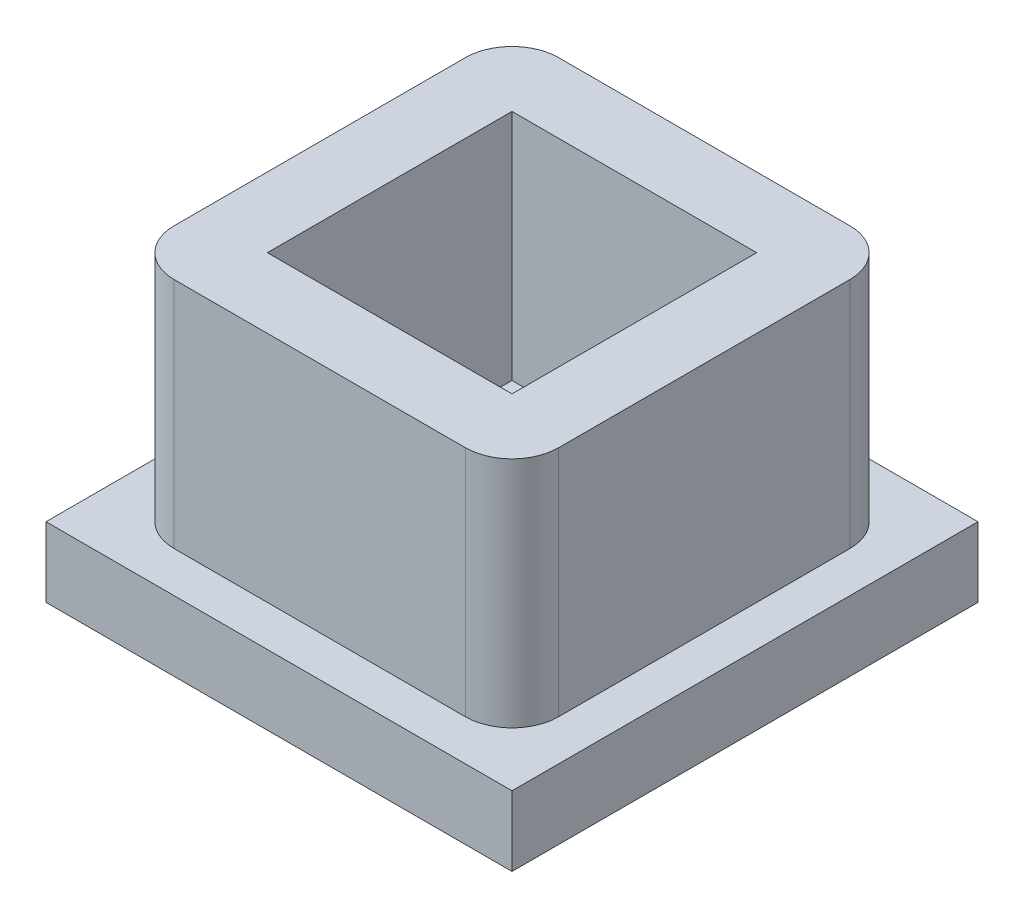
from build123d import *

# Parameters (mm, degrees)
SKETCH1_W           = 20
SKETCH1_H           = 20
BOSS_EXTRUDE1_DEPTH = 3
SKETCH2_W           = 16.5
SKETCH2_H           = 16.5
SKETCH2_W_2         = 10.5
SKETCH2_H_2         = 10.5
BOSS_EXTRUDE2_DEPTH = 10
FILLET1_R           = 2


with BuildPart() as part:
    # Sketch1 → Boss-Extrude1 (new body)
    with BuildSketch(Plane(origin=(0, 0, 0), x_dir=(1, 0, 0), z_dir=(0, 1, 0))):
        Rectangle(SKETCH1_W, SKETCH1_H)
    extrude(amount=BOSS_EXTRUDE1_DEPTH)

    # Sketch2 → Boss-Extrude2 (add)
    with BuildSketch(Plane(origin=(0, 3, 0), x_dir=(1, 0, 0), z_dir=(0, 1, 0))):
        Rectangle(SKETCH2_W, SKETCH2_H)
        Rectangle(SKETCH2_W_2, SKETCH2_H_2, mode=Mode.SUBTRACT)
    extrude(amount=BOSS_EXTRUDE2_DEPTH)

    # Fillet1
    fillet1_edges = [part.edges().sort_by_distance(p)[0] for p in [
        (8.25, 8, 8.25),
        (8.25, 8, -8.25),
        (-8.25, 8, -8.25),
        (-8.25, 8, 8.25),
    ]]
    fillet(fillet1_edges, radius=FILLET1_R)


solid = part.part
